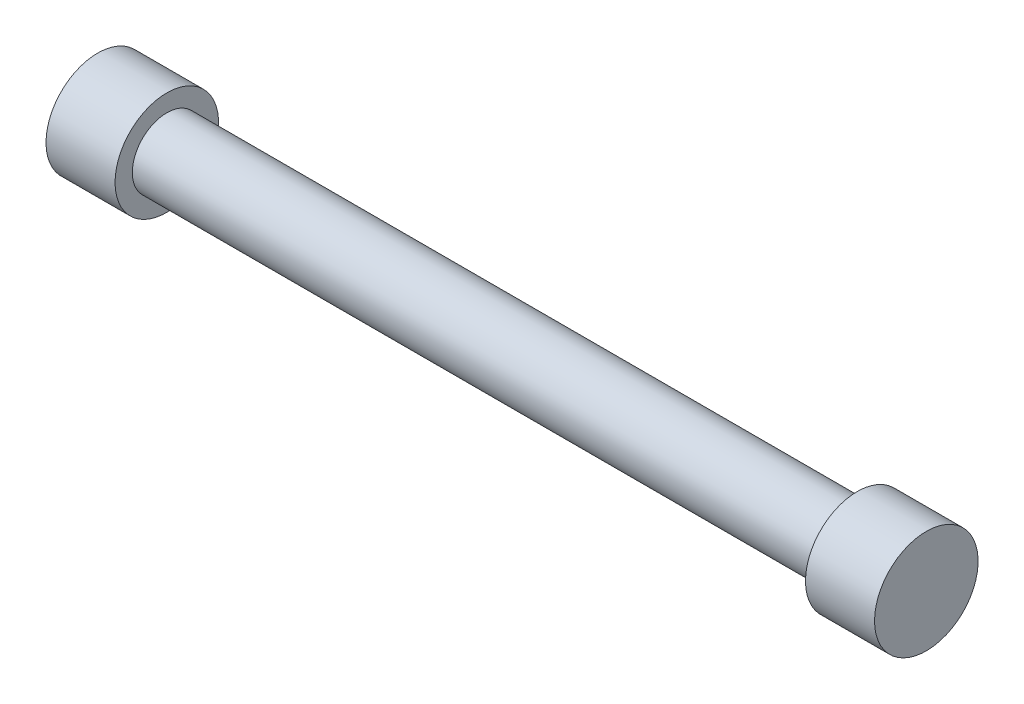
from build123d import *


with BuildPart() as part:
    # Sketch1 → Revolve1 (revolve)
    with BuildSketch(Plane(origin=(0, 0, 0), x_dir=(1, 0, 0), z_dir=(0, 1, 0))):
        Polygon((0, 0), (0, -1.5), (2, -1.5), (2, -1), (22, -1), (22, -1.5), (24, -1.5), (24, 0), align=None)
    revolve(axis=Axis((0, 0, 0), (1, 0, 0)))


solid = part.part
